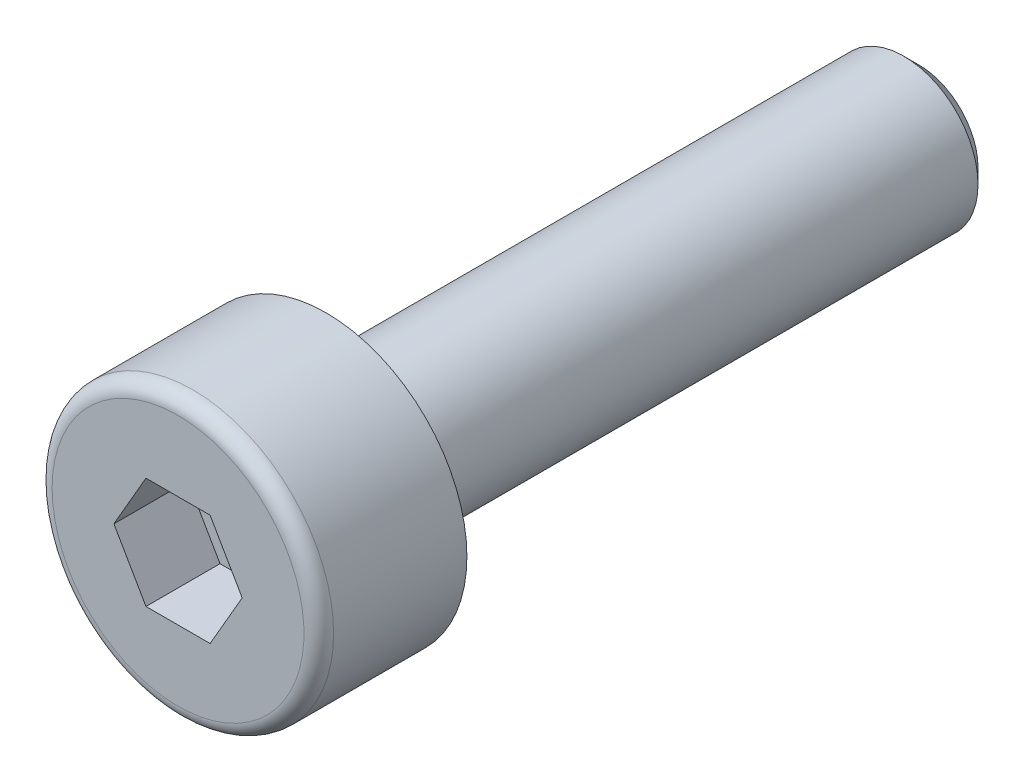
from build123d import *

# Parameters (mm, degrees)
EXTRUDE1_DEPTH = 1
FILLET1_R      = 0.2
CHAMFER_1_SIZE = 0.2


with BuildPart() as part:
    # Sketch2 → Matrix-Rotate1 (revolve)
    with BuildSketch(Plane(origin=(0, 0, 0), x_dir=(0, 0, -1), z_dir=(1, 0, 0)), mode=Mode.PRIVATE) as matrix_rotate1_sk:
        Polygon((0, 0), (0, 1.9), (2, 1.9), (2, 1), (10, 1), (10, 0), align=None)
    revolve(matrix_rotate1_sk.sketch.rotate(Axis((0, 0, 0), (0, 0, -1)), 90), axis=Axis((0, 0, 0), (0, 0, -1)))

    # Sketch3 → Extrude1 (cut)
    with BuildSketch(Plane.XY):
        Polygon((0.866025404, 0), (0.433012702, 0.75), (-0.433012702, 0.75), (-0.866025404, 0), (-0.433012702, -0.75), (0.433012702, -0.75), align=None)
    extrude(amount=-EXTRUDE1_DEPTH, mode=Mode.SUBTRACT)

    # Fillet1
    fillet1_edges = [part.edges().sort_by_distance(p)[0] for p in [
        (-1.9, 0, 0),
    ]]
    fillet(fillet1_edges, radius=FILLET1_R)

    # 倒角1
    chamfer_1_edges = [part.edges().sort_by_distance(p)[0] for p in [
        (-1, 0, -10),
    ]]
    chamfer(chamfer_1_edges, length=CHAMFER_1_SIZE)


solid = part.part
